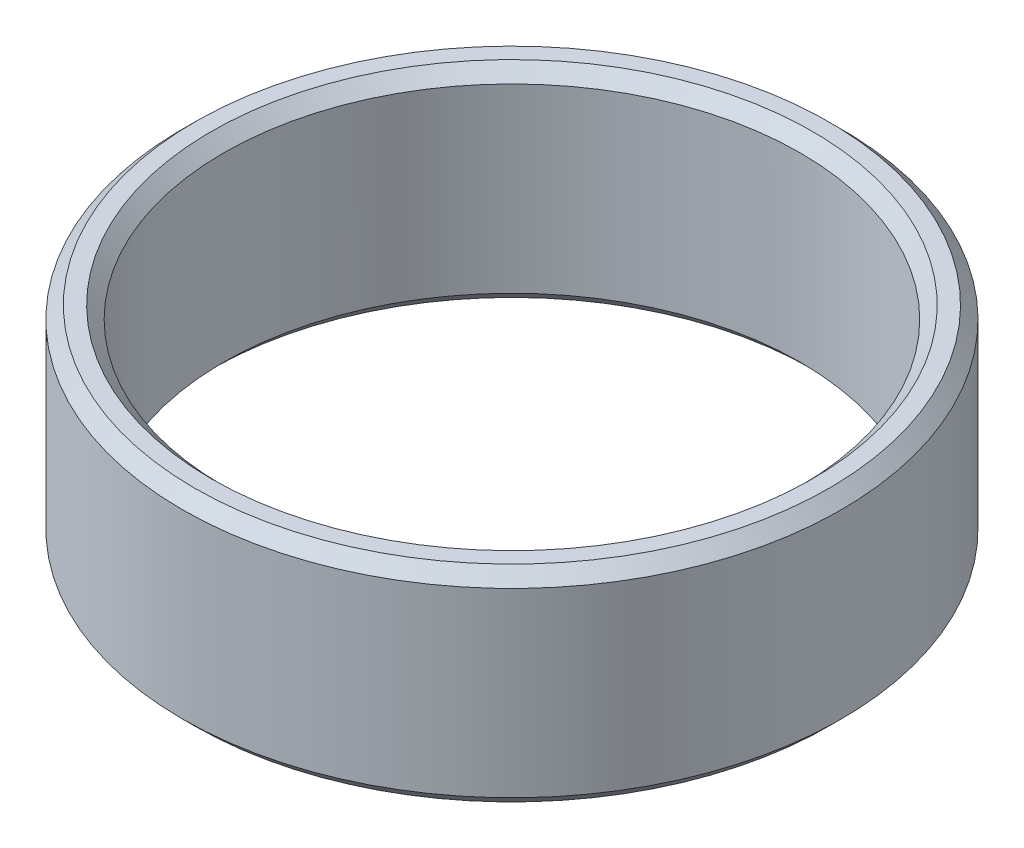
from build123d import *

# Parameters (mm, degrees)
SKETCH1_R           = 8
SKETCH1_R_2         = 7
BOSS_EXTRUDE1_DEPTH = 5
CHAMFER1_SIZE       = 0.3


with BuildPart() as part:
    # Sketch1 → Boss-Extrude1 (new body)
    with BuildSketch(Plane(origin=(0, 0, 0), x_dir=(1, 0, 0), z_dir=(0, 1, 0))):
        with Locations(Location((0, 0, 0), (0, 0, 270))):
            Circle(SKETCH1_R)
        with Locations(Location((0, 0, 0), (0, 0, 270))):
            Circle(SKETCH1_R_2, mode=Mode.SUBTRACT)
    extrude(amount=BOSS_EXTRUDE1_DEPTH)

    # Chamfer1
    chamfer1_edges = [part.edges().sort_by_distance(p)[0] for p in [
        (0, 0, -8),
        (0, 5, -8),
        (0, 0, -7),
        (0, 5, -7),
    ]]
    chamfer(chamfer1_edges, length=CHAMFER1_SIZE)


solid = part.part
